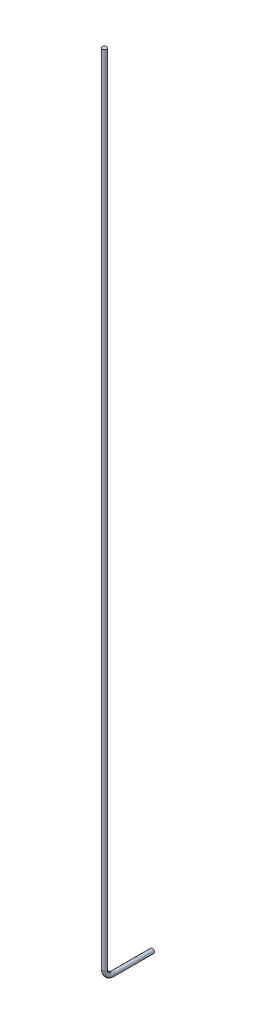
from build123d import *

# Parameters (mm, degrees)
SKETCH_1_R      = 1.39
EXTRUDE_1_DEPTH = 20
SKETCH_2_R      = 1.39


with BuildPart() as part:
    # ｽｹｯﾁ1 → ﾎﾞｽ - 押し出し1 (new body)
    with BuildSketch(Plane.XY):
        Circle(SKETCH_1_R)
    extrude(amount=EXTRUDE_1_DEPTH)

    # ｽｲｰﾌﾟ1: sweep along a path in ｽｹｯﾁ3
    with BuildLine(Plane(origin=(0, 0, 0), x_dir=(0, 0, -1), z_dir=(1, 0, 0))) as sweep_1_path:
        Line((-20, 0), (-25, 0))
        ThreePointArc((-25, 0), (-28.535533906, 1.464466094), (-30, 5))
        Line((-30, 5), (-30, 505))
    # ｽｹｯﾁ2 → ｽｲｰﾌﾟ1 (sweep)
    with BuildSketch(Plane.XY.offset(20)):
        Circle(SKETCH_2_R)
    sweep(path=sweep_1_path.line)


solid = part.part
